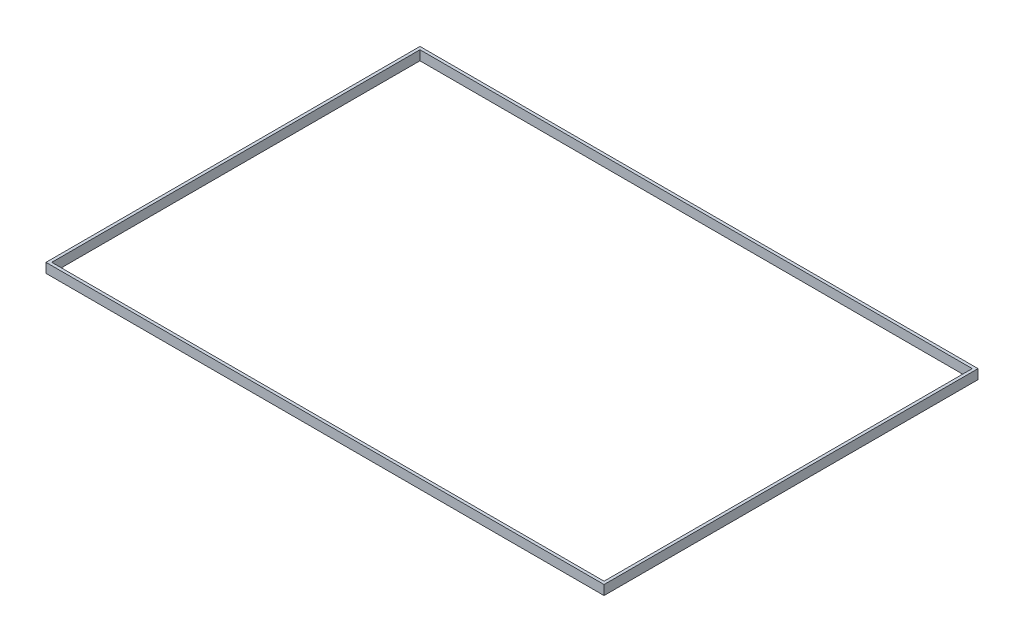
from build123d import *

# Parameters (mm, degrees)
SKETCH1_W           = 3695.7
SKETCH1_H           = 2476.5
SKETCH1_W_2         = 3657.6
SKETCH1_H_2         = 2438.4
BOSS_EXTRUDE1_DEPTH = 63.5


with BuildPart() as part:
    # Sketch1 → Boss-Extrude1 (new body)
    with BuildSketch(Plane(origin=(0, 0, 0), x_dir=(1, 0, 0), z_dir=(0, 1, 0))):
        with Locations((1847.85, 1238.25)):
            Rectangle(SKETCH1_W, SKETCH1_H)
        with Locations((1847.85, 1238.25)):
            Rectangle(SKETCH1_W_2, SKETCH1_H_2, mode=Mode.SUBTRACT)
    extrude(amount=BOSS_EXTRUDE1_DEPTH)


solid = part.part
